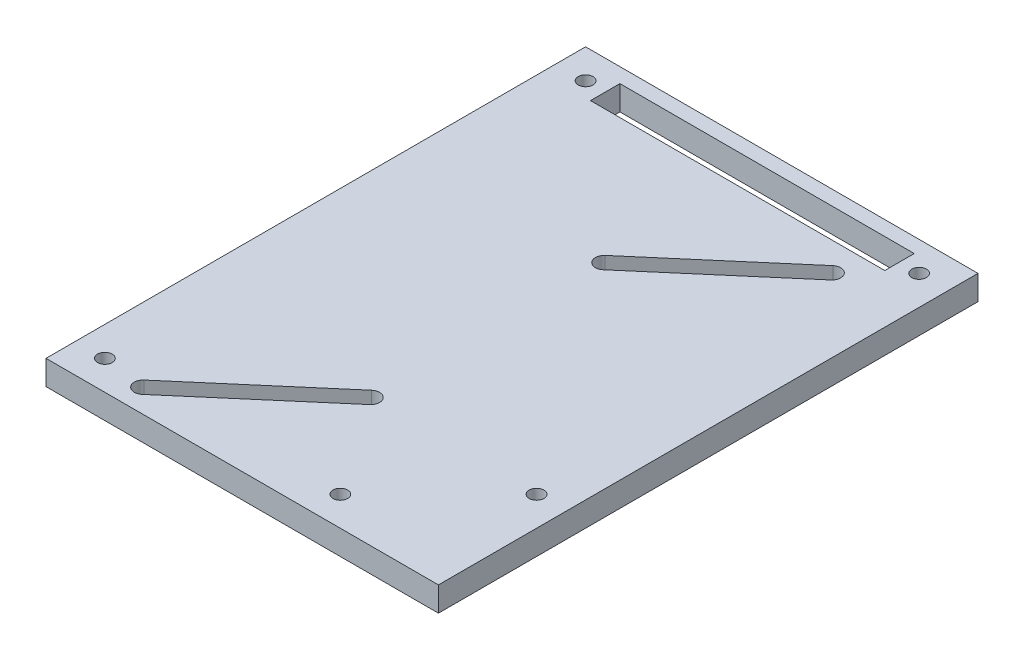
from build123d import *

# Parameters (mm, degrees)
SKETCH1_W           = 101.6
SKETCH1_H           = 139.7
BOSS_EXTRUDE1_DEPTH = 6.35
CUT_EXTRUDE1_DEPTH  = 92.800885072
SKETCH4_W           = 76.2
SKETCH4_H           = 7.62
CUT_EXTRUDE2_DEPTH  = 92.800885072
SKETCH7_R           = 1.905
CUT_EXTRUDE3_DEPTH  = 92.800885072


with BuildPart() as part:
    # Sketch1 → Boss-Extrude1 (new body)
    with BuildSketch(Plane(origin=(0, 0, 0), x_dir=(1, 0, 0), z_dir=(0, 1, 0))):
        with Locations((0, 6.35)):
            Rectangle(SKETCH1_W, SKETCH1_H)
    extrude(amount=BOSS_EXTRUDE1_DEPTH)

    # Sketch3 → Cut-Extrude1 (cut, through all)
    with BuildSketch(Plane(origin=(0, 6.35, 0), x_dir=(1, 0, 0), z_dir=(0, 1, 0))):
        with BuildLine():
            Line((-1.486564617, 31.962640907), (30.263435383, 59.140640907))
            ThreePointArc((30.263435383, 59.140640907), (33.486640907, 58.890564617), (33.236564617, 55.667359093))
            Line((33.236564617, 55.667359093), (1.486564617, 28.489359093))
            ThreePointArc((1.486564617, 28.489359093), (-1.736640907, 28.739435383), (-1.486564617, 31.962640907))
        make_face()
        with BuildLine():
            Line((1.486564617, -31.962640907), (-30.263435383, -59.140640907))
            ThreePointArc((-30.263435383, -59.140640907), (-33.486640907, -58.890564617), (-33.236564617, -55.667359093))
            Line((-33.236564617, -55.667359093), (-1.486564617, -28.489359093))
            ThreePointArc((-1.486564617, -28.489359093), (1.736640907, -28.739435383), (1.486564617, -31.962640907))
        make_face()
    extrude(amount=-CUT_EXTRUDE1_DEPTH, mode=Mode.SUBTRACT)

    # Sketch4 → Cut-Extrude2 (cut, through all)
    with BuildSketch(Plane(origin=(0, 6.35, 0), x_dir=(1, 0, 0), z_dir=(0, 1, 0))):
        with Locations((0, 68.58)):
            Rectangle(SKETCH4_W, SKETCH4_H)
    extrude(amount=-CUT_EXTRUDE2_DEPTH, mode=Mode.SUBTRACT)

    # Sketch7 → Cut-Extrude3 (cut, through all)
    with BuildSketch(Plane(origin=(0, 6.35, 0), x_dir=(1, 0, 0), z_dir=(0, 1, 0))):
        with Locations(Location((-43.18, 68.58, 0), (0, 0, 270))):
            Circle(SKETCH7_R)
        with Locations(Location((43.18, 68.58, 0), (0, 0, 90))):
            Circle(SKETCH7_R)
        with Locations(Location((-43.18, -55.88, 0), (0, 0, 270))):
            Circle(SKETCH7_R)
        with Locations(Location((17.78, -55.88, 0), (0, 0, 270))):
            Circle(SKETCH7_R)
        with Locations(Location((43.18, -30.48, 0), (0, 0, 90))):
            Circle(SKETCH7_R)
    extrude(amount=-CUT_EXTRUDE3_DEPTH, mode=Mode.SUBTRACT)


solid = part.part
